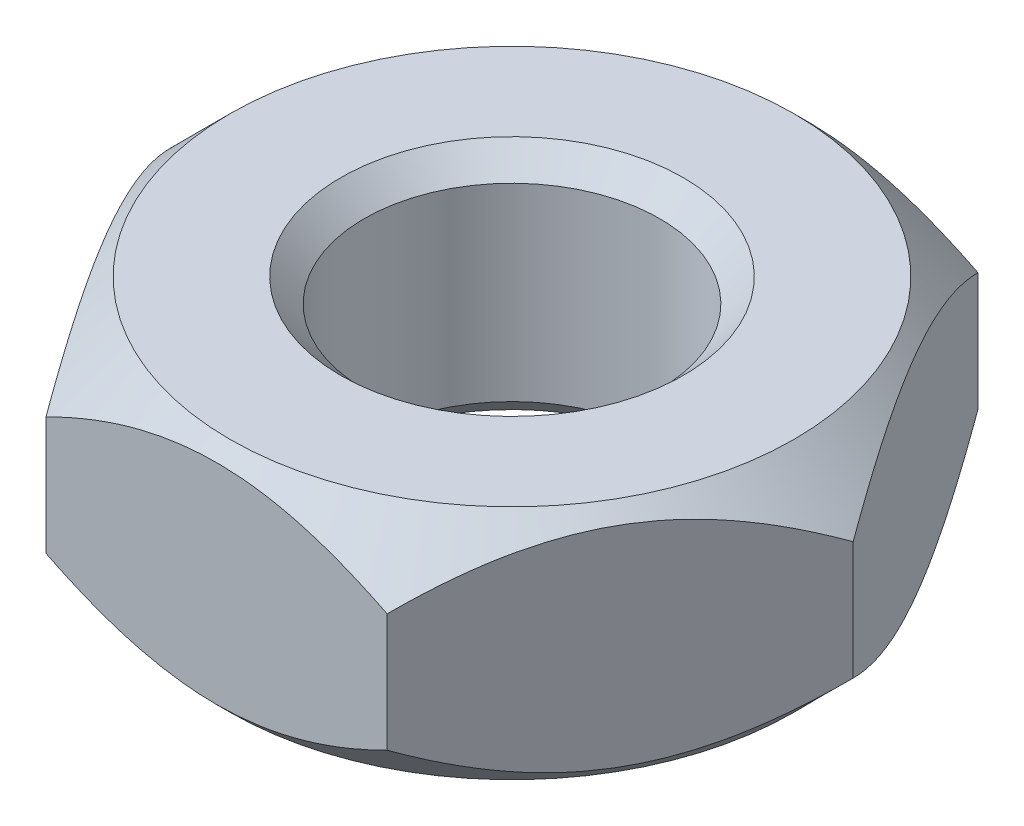
from build123d import *

# Parameters (mm, degrees)
EXTRUDE_1_DEPTH     = 2
SKETCH_5_R          = 1.25
CUT_EXTRUDE_1_DEPTH = 5.310839052
CHAMFER_1_SIZE      = 0.2


with BuildPart() as part:
    # Эскиз1 → Вытянуть1 (new body)
    with BuildSketch(Plane(origin=(0, 0, 0), x_dir=(1, 0, 0), z_dir=(0, 1, 0))):
        Polygon((-1.443375673, 2.5), (1.443375673, 2.5), (2.886751346, 0), (1.443375673, -2.5), (-1.443375673, -2.5), (-2.886751346, 0), align=None)
    extrude(amount=-EXTRUDE_1_DEPTH)

    # Эскиз5 → Вырез-Вытянуть1 (cut, through all)
    with BuildSketch(Plane.XZ.offset(2)):
        with Locations(Location((0, 0, 0), (0, 0, 270))):
            Circle(SKETCH_5_R)
    extrude(amount=-CUT_EXTRUDE_1_DEPTH, mode=Mode.SUBTRACT)

    # Эскиз4 → Вырез-Повернуть1 (revolve, cut)
    with BuildSketch(Plane.XY, mode=Mode.PRIVATE) as cut_revolve_1_sk:
        Polygon((-2.886751346, -0.5), (-2.386751346, 0), (-2.886751346, 0), align=None)
        Polygon((-2.886751346, -1.5), (-2.386751346, -2), (-2.886751346, -2), align=None)
    revolve(cut_revolve_1_sk.sketch.rotate(Axis((0, 0, 0), (0, -1, 0)), 120.000000241), axis=Axis((0, 0, 0), (0, -1, 0)), mode=Mode.SUBTRACT)

    # Фаска1
    chamfer_1_edges = [part.edges().sort_by_distance(p)[0] for p in [
        (0, 0, 1.25),
        (0, -2, 1.25),
    ]]
    chamfer(chamfer_1_edges, length=CHAMFER_1_SIZE)


solid = part.part
